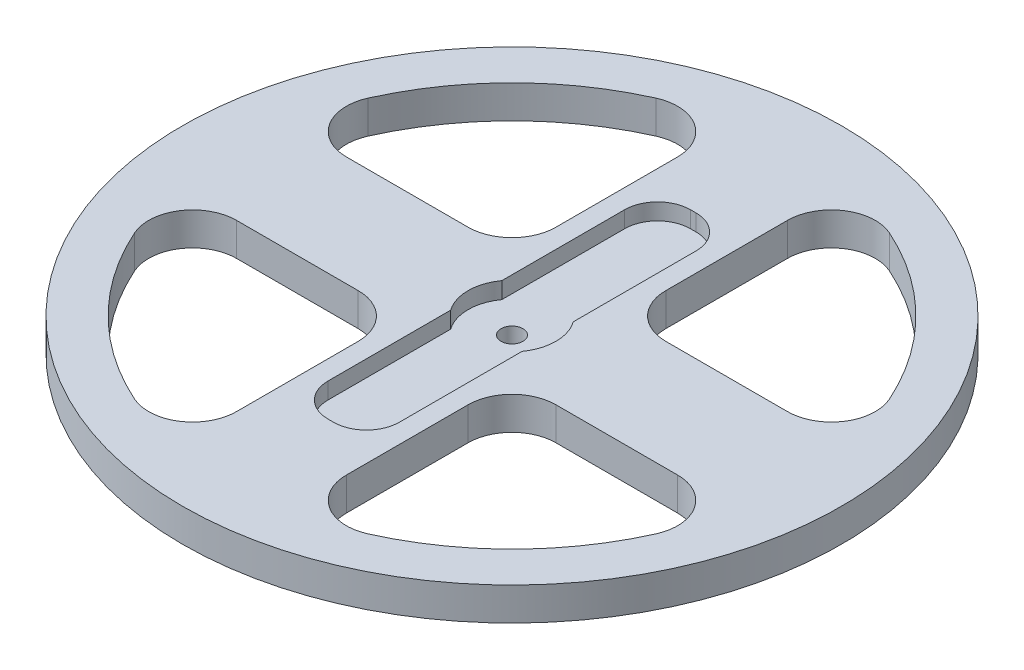
from build123d import *

# Parameters (mm, degrees)
SKETCH1_R           = 30
BOSS_EXTRUDE1_DEPTH = 3
CUT_EXTRUDE1_DEPTH  = 1.5
CUT_EXTRUDE2_DEPTH  = 3
SKETCH4_R           = 1
CUT_EXTRUDE3_DEPTH  = 3
FILLET1_R           = 4
FILLET2_R           = 3


with BuildPart() as part:
    # Sketch1 → Boss-Extrude1 (new body)
    with BuildSketch(Plane(origin=(0, 0, 0), x_dir=(1, 0, 0), z_dir=(0, 1, 0))):
        with Locations(Location((0, 0, 0), (0, 0, 270))):
            Circle(SKETCH1_R)
    extrude(amount=BOSS_EXTRUDE1_DEPTH)

    # Sketch2 → Cut-Extrude1 (cut)
    with BuildSketch(Plane(origin=(0, 3, 0), x_dir=(1, 0, 0), z_dir=(0, 1, 0))):
        with BuildLine():
            Line((-3.25, 16.5), (-3.25, 2.331844763))
            ThreePointArc((-3.25, 2.331844763), (-4, 0), (-3.25, -2.331844763))
            Line((-3.25, -2.331844763), (-3.25, -16.5))
            Line((-3.25, -16.5), (3.25, -16.5))
            Line((3.25, -16.5), (3.25, -2.331844763))
            ThreePointArc((3.25, -2.331844763), (4, 0), (3.25, 2.331844763))
            Line((3.25, 2.331844763), (3.25, 16.5))
            Line((3.25, 16.5), (-3.25, 16.5))
        make_face()
    extrude(amount=-CUT_EXTRUDE1_DEPTH, mode=Mode.SUBTRACT)

    # Sketch3 → Cut-Extrude2 (cut)
    with BuildSketch(Plane(origin=(0, 3, 0), x_dir=(1, 0, 0), z_dir=(0, 1, 0))):
        with BuildLine():
            Line((-5, -25.514701644), (-5, -5))
            Line((-5, -5), (-25.514701644, -5))
            ThreePointArc((-25.514701644, -5), (-18.384776311, -18.384776311), (-5, -25.514701644))
        make_face()
        with BuildLine():
            Line((5, -25.514701644), (5, -5))
            Line((5, -5), (25.514701644, -5))
            ThreePointArc((25.514701644, -5), (18.384776311, -18.384776311), (5, -25.514701644))
        make_face()
        with BuildLine():
            Line((25.514701644, 5), (5, 5))
            Line((5, 5), (5, 25.514701644))
            ThreePointArc((5, 25.514701644), (18.384776311, 18.384776311), (25.514701644, 5))
        make_face()
        with BuildLine():
            Line((-5, 5), (-5, 25.514701644))
            ThreePointArc((-5, 25.514701644), (-18.384776311, 18.384776311), (-25.514701644, 5))
            Line((-25.514701644, 5), (-5, 5))
        make_face()
    extrude(amount=-CUT_EXTRUDE2_DEPTH, mode=Mode.SUBTRACT)

    # Sketch4 → Cut-Extrude3 (cut)
    with BuildSketch(Plane.XZ):
        with Locations(Location((0, 0, 0), (0, 0, 270))):
            Circle(SKETCH4_R)
    extrude(amount=-CUT_EXTRUDE3_DEPTH, mode=Mode.SUBTRACT)

    # Fillet1
    fillet1_edges = [part.edges().sort_by_distance(p)[0] for p in [
        (-25.514701644, 1.5, -5),
        (-5, 1.5, -25.514701644),
        (-5, 1.5, -5),
        (25.514701644, 1.5, 5),
        (5, 1.5, 25.514701644),
        (5, 1.5, 5),
        (5, 1.5, -25.514701644),
        (25.514701644, 1.5, -5),
        (5, 1.5, -5),
        (-5, 1.5, 25.514701644),
        (-25.514701644, 1.5, 5),
        (-5, 1.5, 5),
    ]]
    fillet(fillet1_edges, radius=FILLET1_R)

    # Fillet2
    fillet2_edges = [part.edges().sort_by_distance(p)[0] for p in [
        (3.25, 2.25, 16.5),
        (-3.25, 2.25, 16.5),
        (-3.25, 2.25, -16.5),
        (3.25, 2.25, -16.5),
    ]]
    fillet(fillet2_edges, radius=FILLET2_R)


solid = part.part
